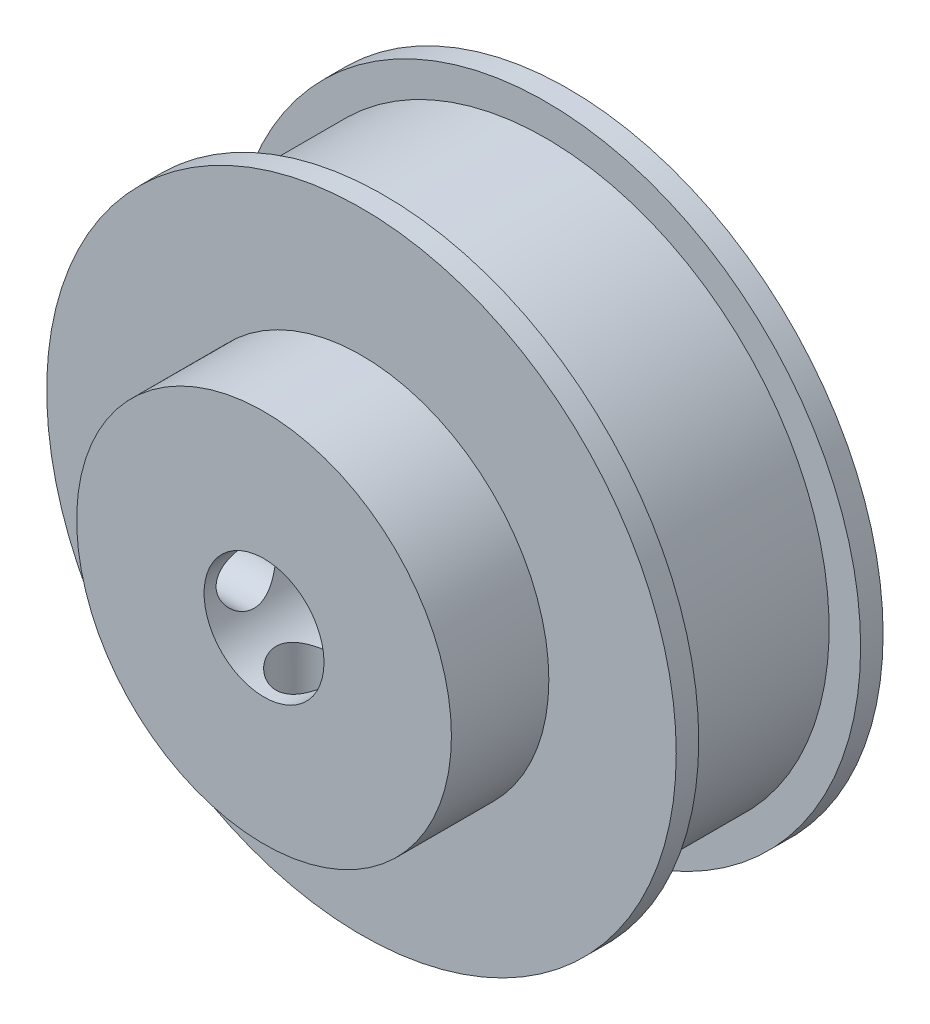
from build123d import *

# Parameters (mm, degrees)
CROQUIS1_R              = 21
SALIENTE_EXTRUIR1_DEPTH = 1.5
CROQUIS2_R              = 18.9
SALIENTE_EXTRUIR2_DEPTH = 10.8
CROQUIS3_R              = 21
SALIENTE_EXTRUIR3_DEPTH = 1.5
CROQUIS8_R              = 12.5
SALIENTE_EXTRUIR5_DEPTH = 6.5
CROQUIS6_R              = 2
CORTAR_EXTRUIR3_DEPTH   = 36.973462441
CROQUIS5_R              = 2
CORTAR_EXTRUIR2_DEPTH   = 36.973462498
CROQUIS4_R              = 4
CORTAR_EXTRUIR1_DEPTH   = 36.973462441


with BuildPart() as part:
    # Croquis1 → Saliente-Extruir1 (new body)
    with BuildSketch(Plane.XY):
        Circle(CROQUIS1_R)
    extrude(amount=SALIENTE_EXTRUIR1_DEPTH)

    # Croquis2 → Saliente-Extruir2 (add)
    with BuildSketch(Plane.XY.offset(1.5)):
        with Locations(Location((0, 0, 0), (0, 0, 180))):
            Circle(CROQUIS2_R)
    extrude(amount=SALIENTE_EXTRUIR2_DEPTH)

    # Croquis3 → Saliente-Extruir3 (add)
    with BuildSketch(Plane.XY.offset(12.3)):
        Circle(CROQUIS3_R)
    extrude(amount=SALIENTE_EXTRUIR3_DEPTH)

    # Croquis8 → Saliente-Extruir5 (add)
    with BuildSketch(Plane.XY.offset(13.8)):
        with Locations(Location((0, 0, 0), (0, 0, 180))):
            Circle(CROQUIS8_R)
    extrude(amount=SALIENTE_EXTRUIR5_DEPTH)

    # Croquis6 → Cortar-Extruir3 (cut, through all)
    with BuildSketch(Plane(origin=(0, 0, 0), x_dir=(1, 0, 0), z_dir=(0, 1, 0))):
        with Locations(Location((0, -17.5, 0), (0, 0, 270))):
            Circle(CROQUIS6_R)
    extrude(amount=-CORTAR_EXTRUIR3_DEPTH, mode=Mode.SUBTRACT)

    # Croquis5 → Cortar-Extruir2 (cut, through all)
    with BuildSketch(Plane(origin=(0, 0, 0), x_dir=(0, 0, -1), z_dir=(1, 0, 0))):
        with Locations(Location((-17.5, 0, 0), (0, 0, 180))):
            Circle(CROQUIS5_R)
    extrude(amount=-CORTAR_EXTRUIR2_DEPTH, mode=Mode.SUBTRACT)

    # Croquis4 → Cortar-Extruir1 (cut, through all)
    with BuildSketch(Plane.XY.offset(20.3)):
        Circle(CROQUIS4_R)
    extrude(amount=-CORTAR_EXTRUIR1_DEPTH, mode=Mode.SUBTRACT)


solid = part.part
